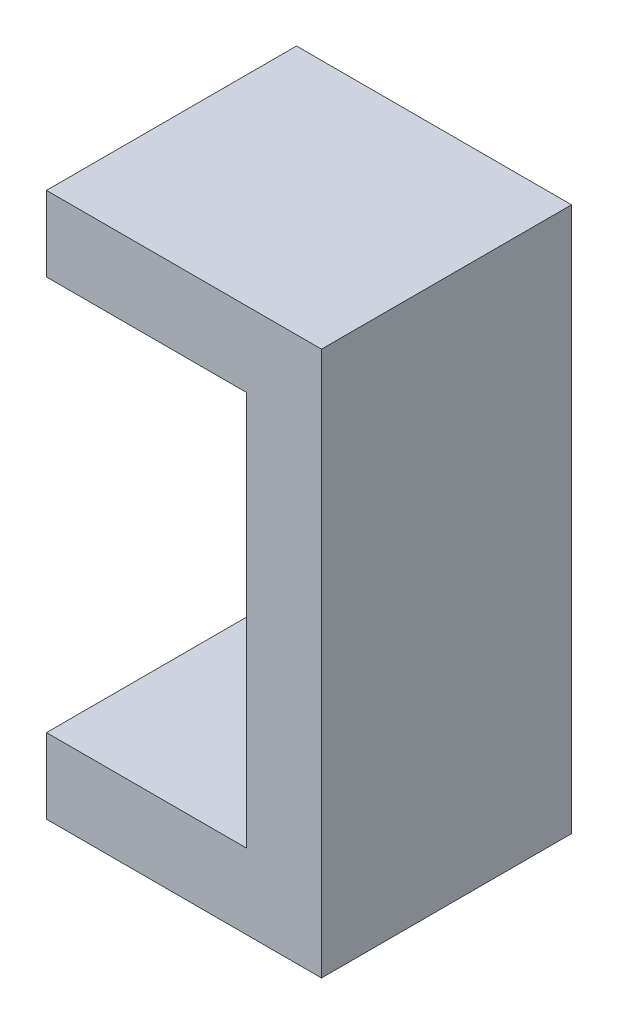
from build123d import *

# Parameters (mm, degrees)
SKETCH1_W           = 11.176
SKETCH1_H           = 10.16
BOSS_EXTRUDE1_DEPTH = 3.048
SKETCH2_W           = 3.048
SKETCH2_H           = 10.16
BOSS_EXTRUDE2_DEPTH = 19.0815
SKETCH3_W           = 10.16
SKETCH3_H           = 3.048
BOSS_EXTRUDE3_DEPTH = 8.128
SKETCH4_W           = 3.048
SKETCH4_H           = 10.16
BOSS_EXTRUDE4_DEPTH = 1.27
BOSS_EXTRUDE4_TAPER = 45


with BuildPart() as part:
    # Sketch1 → Boss-Extrude1 (new body)
    with BuildSketch(Plane.XZ.offset(13.5255)):
        with Locations((2.54, -8.349079223)):
            Rectangle(SKETCH1_W, SKETCH1_H)
    extrude(amount=BOSS_EXTRUDE1_DEPTH)

    # Sketch2 → Boss-Extrude2 (add)
    with BuildSketch(Plane(origin=(0, -13.5255, 0), x_dir=(1, 0, 0), z_dir=(0, 1, 0))):
        with Locations((6.604, 8.349079223)):
            Rectangle(SKETCH2_W, SKETCH2_H)
    extrude(amount=BOSS_EXTRUDE2_DEPTH)

    # Sketch3 → Boss-Extrude3 (add)
    with BuildSketch(Plane.ZY.offset(-5.08)):
        with Locations((-8.349079223, 4.032)):
            Rectangle(SKETCH3_W, SKETCH3_H)
    extrude(amount=BOSS_EXTRUDE3_DEPTH)

    # Sketch4 → Boss-Extrude4 (add)
    with BuildSketch(Plane.XZ.offset(-2.508)):
        with Locations((-1.524, -8.349079223)):
            Rectangle(SKETCH4_W, SKETCH4_H)
    extrude(amount=BOSS_EXTRUDE4_DEPTH, taper=BOSS_EXTRUDE4_TAPER)


solid = part.part
